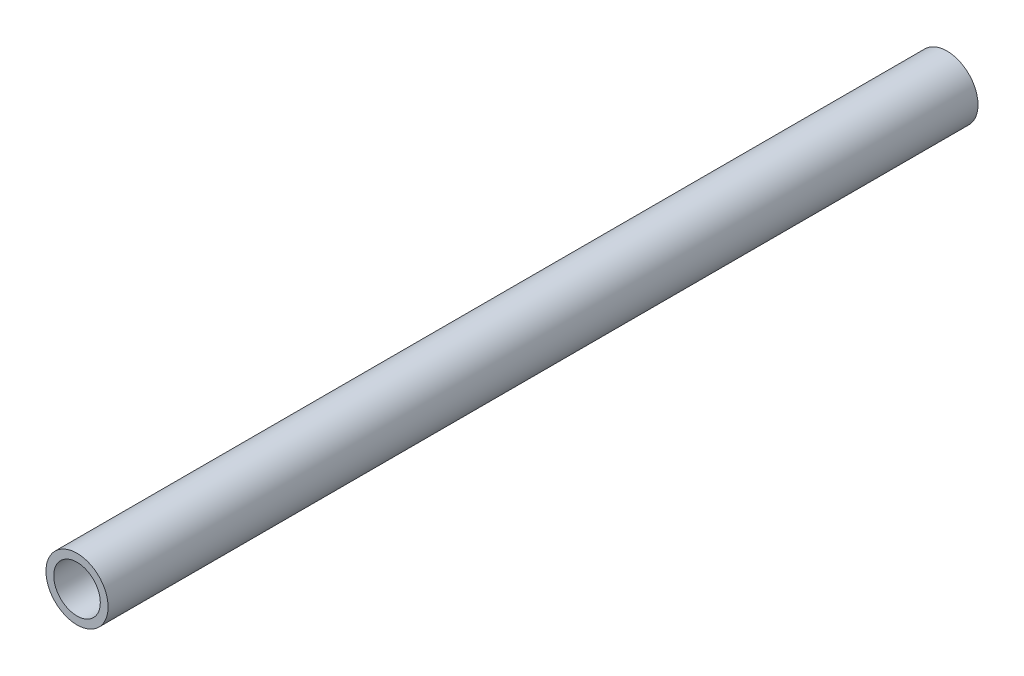
from build123d import *

# Parameters (mm, degrees)
SKETCH1_R           = 12.7
SKETCH1_R_2         = 9.525
BOSS_EXTRUDE1_DEPTH = 355.6


with BuildPart() as part:
    # Sketch1 → Boss-Extrude1 (new body)
    with BuildSketch(Plane.XY):
        Circle(SKETCH1_R)
        Circle(SKETCH1_R_2, mode=Mode.SUBTRACT)
    extrude(amount=-BOSS_EXTRUDE1_DEPTH)


solid = part.part
